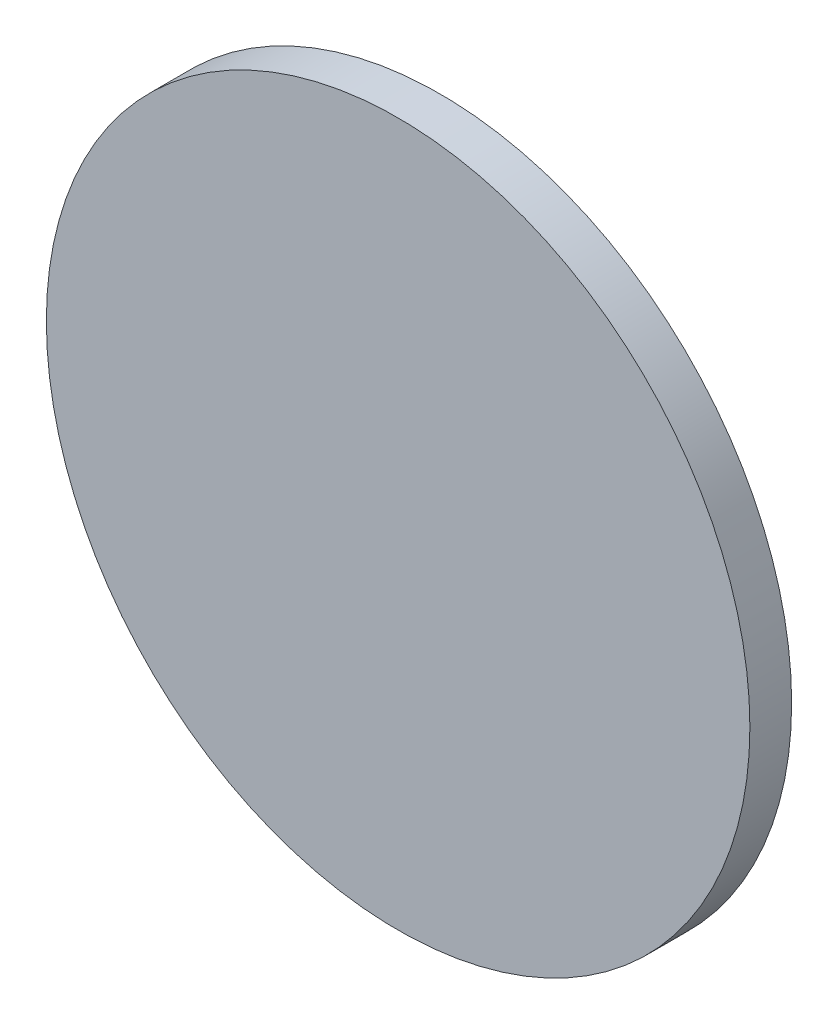
from build123d import *

# Parameters (mm, degrees)
SKETCH1_R           = 84.25101663
BOSS_EXTRUDE1_DEPTH = 10


with BuildPart() as part:
    # Sketch1 → Boss-Extrude1 (new body)
    with BuildSketch(Plane.XY):
        Circle(SKETCH1_R)
    extrude(amount=BOSS_EXTRUDE1_DEPTH)


solid = part.part
